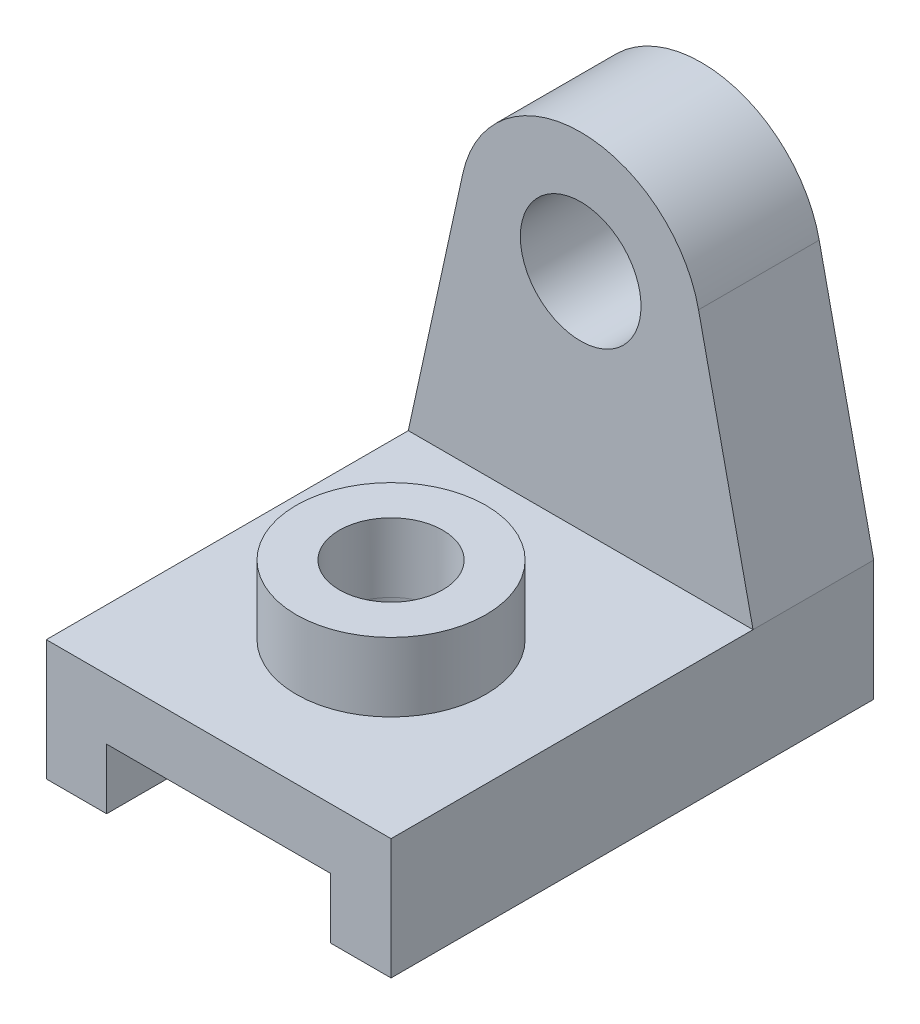
from build123d import *

# Parameters (mm, degrees)
EXTRUDE_1_DEPTH     = 56
SKETCH_3_R          = 7
EXTRUDE_2_DEPTH     = 14
SKETCH_2_R          = 11
SKETCH_2_R_2        = 6
EXTRUDE_3_DEPTH     = 8
SKETCH_8_R          = 6.005758489
CUT_EXTRUDE_1_DEPTH = 10


with BuildPart() as part:
    # 草图1 → 凸台-拉伸1 (new body)
    with BuildSketch(Plane.XY):
        Polygon((-20, 0), (20, 0), (20, -14), (13, -14), (13, -7), (-13, -7), (-13, -14), (-20, -14), align=None)
    extrude(amount=-EXTRUDE_1_DEPTH)

    # 草图3 → 凸台-拉伸2 (add)
    with BuildSketch(Plane(origin=(0, 0, -56), x_dir=(-1, 0, 0), z_dir=(0, 0, -1))):
        with BuildLine():
            ThreePointArc((13.678424719, 28.98340363), (0, 40), (-13.678424719, 28.98340363))
            Line((-13.678424719, 28.98340363), (-20, 0))
            Line((-20, 0), (20, 0))
            Line((20, 0), (13.678424719, 28.98340363))
        make_face()
        with Locations((0, 26)):
            Circle(SKETCH_3_R, mode=Mode.SUBTRACT)
    extrude(amount=-EXTRUDE_2_DEPTH)

    # 草图2 → 凸台-拉伸3 (add)
    with BuildSketch(Plane(origin=(0, 0, 0), x_dir=(1, 0, 0), z_dir=(0, 1, 0))):
        with Locations(Location((0, 20, 0), (0, 0, 270))):
            Circle(SKETCH_2_R)
        with Locations(Location((0, 20, 0), (0, 0, 270))):
            Circle(SKETCH_2_R_2, mode=Mode.SUBTRACT)
    extrude(amount=EXTRUDE_3_DEPTH)

    # 草图8 → 切除-拉伸1 (cut)
    with BuildSketch(Plane(origin=(0, 0, 0), x_dir=(1, 0, 0), z_dir=(0, 1, 0))):
        with Locations(Location((0, 19.994241511, 0), (0, 0, 90.010673287))):
            Circle(SKETCH_8_R)
    extrude(amount=-CUT_EXTRUDE_1_DEPTH, mode=Mode.SUBTRACT)


solid = part.part
